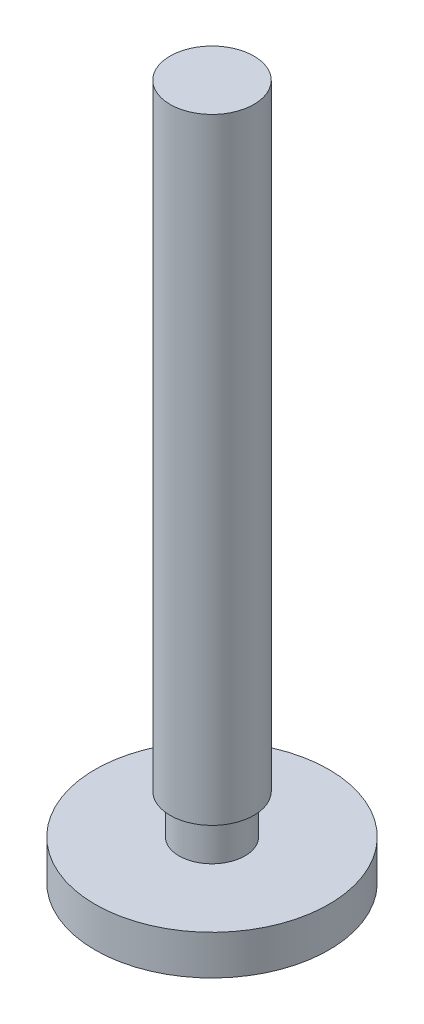
from build123d import *

# Parameters (mm, degrees)
SALIENTE_EXTRUIR1_DEPTH = 20
CORTAR_EXTRUIR1_REACH   = 24.289
CROQUIS2_R              = 3.75
SALIENTE_EXTRUIR2_START = -9
CROQUIS3_R              = 3.75
SALIENTE_EXTRUIR2_DEPTH = 9
CROQUIS4_R              = 4.765
SALIENTE_EXTRUIR3_DEPTH = 70
CROQUIS5_R              = 13.287682266
SALIENTE_EXTRUIR4_DEPTH = 4.5


with BuildPart() as part:
    # Croquis1 → Saliente-Extruir1 (new body)
    with BuildSketch(Plane.XY):
        Polygon((-8.75, 2.25), (8.75, 2.25), (4.25, -2.25), (-4.25, -2.25), align=None)
    extrude(amount=SALIENTE_EXTRUIR1_DEPTH)

    # Croquis2 → Cortar-Extruir1 (cut, up to next)
    with BuildSketch(Plane(origin=(0, 2.25, 0), x_dir=(1, 0, 0), z_dir=(0, 1, 0)), mode=Mode.PRIVATE) as cortar_extruir1_sk1:
        with Locations(Location((0, -10, 0), (0, 0, 270))):
            Circle(CROQUIS2_R)
    cortar_extruir1_tool1 = extrude(cortar_extruir1_sk1.sketch, amount=-CORTAR_EXTRUIR1_REACH, mode=Mode.PRIVATE) & part.part
    add(cortar_extruir1_tool1.solids().sort_by_distance((0, 2.25, 10))[0], mode=Mode.SUBTRACT)

    # Croquis3 → Saliente-Extruir2 (add)
    with BuildSketch(Plane.XZ.offset(2.25).offset(SALIENTE_EXTRUIR2_START)):
        with Locations(Location((0, 10, 0), (0, 0, 270))):
            Circle(CROQUIS3_R)
    extrude(amount=SALIENTE_EXTRUIR2_DEPTH)

    # Croquis4 → Saliente-Extruir3 (add)
    with BuildSketch(Plane(origin=(0, 6.75, 0), x_dir=(1, 0, 0), z_dir=(0, 1, 0))):
        with Locations(Location((0, -10, 0), (0, 0, 270))):
            Circle(CROQUIS4_R)
    extrude(amount=SALIENTE_EXTRUIR3_DEPTH)

    # Croquis5 → Saliente-Extruir4 (add)
    with BuildSketch(Plane(origin=(0, 2.25, 0), x_dir=(1, 0, 0), z_dir=(0, 1, 0))):
        with Locations(Location((0, -10, 0), (0, 0, 270))):
            Circle(CROQUIS5_R)
    extrude(amount=-SALIENTE_EXTRUIR4_DEPTH)


solid = part.part
